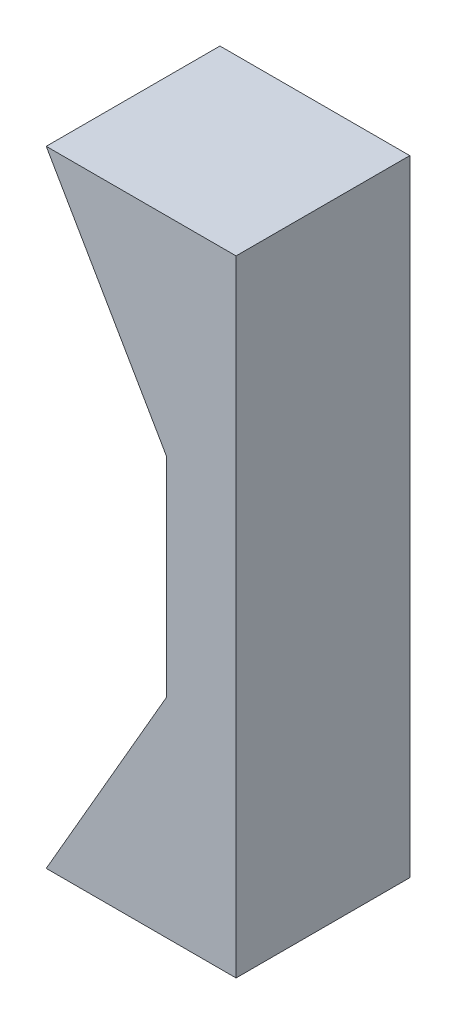
from build123d import *

# Parameters (mm, degrees)
BOSS_EXTRUDE1_DEPTH = 50


with BuildPart() as part:
    # Sketch1 → Boss-Extrude1 (new body)
    with BuildSketch(Plane.XY):
        Polygon((0, 30), (0, -30), (-34.641016151, -90), (0, -90), (20, -90), (20, 90), (0, 90), (-34.641016151, 90), align=None)
    extrude(amount=BOSS_EXTRUDE1_DEPTH)


solid = part.part
